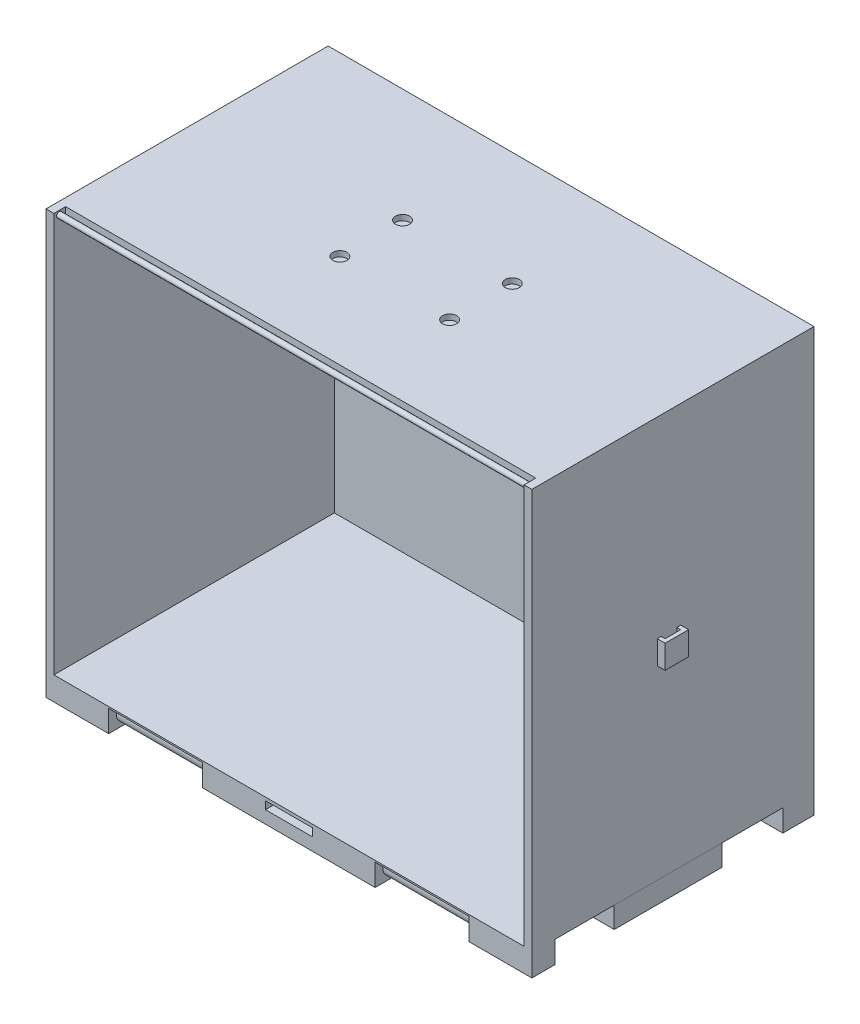
from build123d import *

# Parameters (mm, degrees)
SKETCH1_W                                  = 600
SKETCH1_H                                  = 500
BOSS_EXTRUDE1_DEPTH                        = 175
SHELL1_T                                   = 10
SKETCH3_W                                  = 620
SKETCH3_H                                  = 360
BOSS_EXTRUDE2_DEPTH                        = 20
SKETCH5_W                                  = 120
SKETCH5_H                                  = 150
CUT_EXTRUDE1_DEPTH                         = 50
BOSS_EXTRUDE3_DEPTH                        = 15
SKETCH9_R                                  = 10
SKETCH9_R_2                                = 8.804977656
SKETCH9_R_3                                = 9.206937975
BOSS_EXTRUDE4_DEPTH                        = 180
BOSS_EXTRUDE8_START                        = -260
BOSS_EXTRUDE8_DEPTH                        = 10
SKETCH147_W                                = 600
SKETCH147_H                                = 15
CUT_EXTRUDE2_DEPTH                         = 10
SKETCH148_R                                = 3.5
BOSS_EXTRUDE10_DEPTH                       = 600
SKETCH149_R                                = 9
CUT_EXTRUDE3_DEPTH                         = 7
MIRROR3_AT_THE_SECOND_PLANE_COPY_1_SKETC_R = 9
MIRROR3_AT_THE_SECOND_PLANE_COPY_1_DEPTH   = 7
SKETCH150_W                                = 60
SKETCH150_H                                = 10
CUT_EXTRUDE4_DEPTH                         = 30
SKETCH155_W                                = 290.489530142
SKETCH155_H                                = 28
CUT_EXTRUDE11_DEPTH                        = 716.53321378
BOSS_EXTRUDE11_DEPTH                       = 488
BOSS_EXTRUDE12_DEPTH                       = 125
BOSS_EXTRUDE12_DEPTH_BACK                  = 445
SKETCH160_W                                = 600
SKETCH160_H                                = 500
CUT_EXTRUDE12_DEPTH                        = 8
SKETCH161_W                                = 618
SKETCH161_H                                = 137.7775458
BOSS_EXTRUDE13_DEPTH                       = 28


with BuildPart() as part:
    # Sketch1 → Boss-Extrude1 (new, symmetric)
    with BuildSketch(Plane.XY):
        Rectangle(SKETCH1_W, SKETCH1_H)
    extrude(amount=BOSS_EXTRUDE1_DEPTH, both=True)

    # Shell1
    shell1_openings = [part.faces().sort_by_distance(p)[0] for p in [
        (0, 0, 175),
    ]]
    offset(amount=SHELL1_T, openings=shell1_openings, kind=Kind.INTERSECTION)

    # Sketch3 → Boss-Extrude2 (add)
    with BuildSketch(Plane.XZ.offset(260)):
        with Locations((0, -5)):
            Rectangle(SKETCH3_W, SKETCH3_H)
    extrude(amount=BOSS_EXTRUDE2_DEPTH)

    # Sketch5 → Cut-Extrude1 (cut)
    with BuildSketch(Plane.XZ.offset(280)):
        with Locations((-170, 100)):
            Rectangle(SKETCH5_W, SKETCH5_H)
        with Locations((170, 100)):
            Rectangle(SKETCH5_W, SKETCH5_H)
        with Locations((-220, -185)):
            Rectangle(SKETCH5_W, SKETCH5_H)
        with Locations((220, -185)):
            Rectangle(SKETCH5_W, SKETCH5_H)
    extrude(amount=-CUT_EXTRUDE1_DEPTH, mode=Mode.SUBTRACT)

    # Sketch8 → Boss-Extrude3 (add, symmetric)
    with BuildSketch(Plane(origin=(0, 0, 0), x_dir=(1, 0, 0), z_dir=(0, 1, 0))):
        Polygon((-310, 10), (-315, 10), (-315, -10), (-310, -10), (-310, -15), (-320, -15), (-320, 15), (-310, 15), align=None)
    boss_extrude3 = extrude(amount=BOSS_EXTRUDE3_DEPTH, both=True)

    # Sketch9 → Boss-Extrude4 (add)
    # profile 1 of 2: a face of its own
    with BuildSketch(Plane.ZY.offset(110)):
        with Locations(Location((155, -265, 0), (0, 0, 180))):
            Circle(SKETCH9_R)
        with Locations((155, -265)):
            Circle(SKETCH9_R_2, mode=Mode.SUBTRACT)
    # profile 2 of 2: a face of its own
    with BuildSketch(Plane.ZY.offset(110)):
        with Locations(Location((-165, -265, 0), (0, 0, 180))):
            Circle(SKETCH9_R)
        with Locations(Location((-165, -265, 0), (0, 0, 180))):
            Circle(SKETCH9_R_3, mode=Mode.SUBTRACT)
    boss_extrude4 = extrude(amount=BOSS_EXTRUDE4_DEPTH)

    # Mirror1: Boss-Extrude3, Boss-Extrude4 across plane
    add(boss_extrude3.mirror(Plane(origin=(0, 0, 0), x_dir=(0, 0, 1), z_dir=(1, 0, 0))))
    add(boss_extrude4.mirror(Plane(origin=(0, 0, 0), x_dir=(0, 0, 1), z_dir=(1, 0, 0))))

    # Sketch17 → Boss-Extrude8 (add, symmetric)
    with BuildSketch(Plane(origin=(0, 260, 0), x_dir=(1, 0, 0), z_dir=(0, 1, 0)).offset(BOSS_EXTRUDE8_START)):
        Polygon((-194.223256177, 185), (-204.223256177, 185), (-204.223256177, 191.540544069), (-159.461030104, 191.540544069), (-159.461030104, 185), (-169.461030104, 185), (-169.461030104, 188.442858537), (-194.223256177, 188.442858537), align=None)
        Polygon((194.223256177, 188.442858537), (194.223256177, 185), (204.223256177, 185), (204.223256177, 191.540544069), (159.461030104, 191.540544069), (159.461030104, 185), (169.461030104, 185), (169.461030104, 188.442858537), align=None)
    extrude(amount=BOSS_EXTRUDE8_DEPTH, both=True)

    # Sketch147 → Cut-Extrude2 (cut)
    with BuildSketch(Plane(origin=(0, 260, 0), x_dir=(1, 0, 0), z_dir=(0, 1, 0))):
        with Locations((0, -167.5)):
            Rectangle(SKETCH147_W, SKETCH147_H)
    extrude(amount=-CUT_EXTRUDE2_DEPTH, mode=Mode.SUBTRACT)

    # Sketch148 → Boss-Extrude10 (add)
    with BuildSketch(Plane(origin=(-300, 0, 0), x_dir=(0, 0, -1), z_dir=(1, 0, 0))):
        with Locations(Location((-168, 255, 0), (0, 0, 180))):
            Circle(SKETCH148_R)
    extrude(amount=BOSS_EXTRUDE10_DEPTH)

    # Sketch149 → Cut-Extrude3 (cut)
    with BuildSketch(Plane(origin=(0, 260, 0), x_dir=(1, 0, 0), z_dir=(0, 1, 0))):
        with Locations(Location((-70, 40, 0), (0, 0, 270))):
            Circle(SKETCH149_R)
    cut_extrude3 = extrude(amount=-CUT_EXTRUDE3_DEPTH, mode=Mode.SUBTRACT)

    # Mirror3: Cut-Extrude3 across plane
    add(cut_extrude3.mirror(Plane.XY), mode=Mode.SUBTRACT)

    # Mirror3 at the second plane: Cut-Extrude3 across plane
    add(cut_extrude3.mirror(Plane(origin=(0, 0, 0), x_dir=(0, 0, 1), z_dir=(1, 0, 0))), mode=Mode.SUBTRACT)

    # Mirror3 at the second plane copy 1 sketc → Mirror3 at the second plane copy 1 (cut)
    with BuildSketch(Plane(origin=(0, 260, 0), x_dir=(-1, 0, 0), z_dir=(0, 1, 0))):
        with Locations(Location((-70, 40, 0), (0, 0, 270))):
            Circle(MIRROR3_AT_THE_SECOND_PLANE_COPY_1_SKETC_R)
    extrude(amount=-MIRROR3_AT_THE_SECOND_PLANE_COPY_1_DEPTH, mode=Mode.SUBTRACT)

    # Sketch150 → Cut-Extrude4 (cut)
    with BuildSketch(Plane.XY.offset(175)):
        with Locations((0, -259)):
            Rectangle(SKETCH150_W, SKETCH150_H)
    extrude(amount=-CUT_EXTRUDE4_DEPTH, mode=Mode.SUBTRACT)

    # Sketch155 → Cut-Extrude11 (cut, through all)
    with BuildSketch(Plane.ZY.offset(310)):
        with Locations((0, -266)):
            Rectangle(SKETCH155_W, SKETCH155_H)
    extrude(amount=-CUT_EXTRUDE11_DEPTH, mode=Mode.SUBTRACT)

    # Sketch157 → Boss-Extrude11 (add)
    with BuildSketch(Plane(origin=(-230, 0, 0), x_dir=(0, 0, -1), z_dir=(1, 0, 0))):
        Polygon((-145.244765071, -252), (-175, -252), (-175, -250), (-25, -250), (-25, -252), align=None)
    extrude(amount=BOSS_EXTRUDE11_DEPTH)

    # Sketch159 → Boss-Extrude12 (add, two sides: drawn at the far end of the back side and taken through both)
    with BuildSketch(Plane(origin=(160, 0, 0), x_dir=(0, 0, -1), z_dir=(1, 0, 0)).offset(-BOSS_EXTRUDE12_DEPTH_BACK)):
        Polygon((145.244765071, -252), (185, -252), (185, -230), (175, -230), (175, -250), (110, -250), (110, -252), align=None)
    extrude(amount=BOSS_EXTRUDE12_DEPTH + BOSS_EXTRUDE12_DEPTH_BACK)

    # Sketch160 → Cut-Extrude12 (cut)
    with BuildSketch(Plane.XY.offset(-175)):
        Rectangle(SKETCH160_W, SKETCH160_H)
    extrude(amount=-CUT_EXTRUDE12_DEPTH, mode=Mode.SUBTRACT)

    # Sketch161 → Boss-Extrude13 (add)
    with BuildSketch(Plane.XZ.offset(252)):
        Rectangle(SKETCH161_W, SKETCH161_H)
    extrude(amount=BOSS_EXTRUDE13_DEPTH)


solid = part.part
